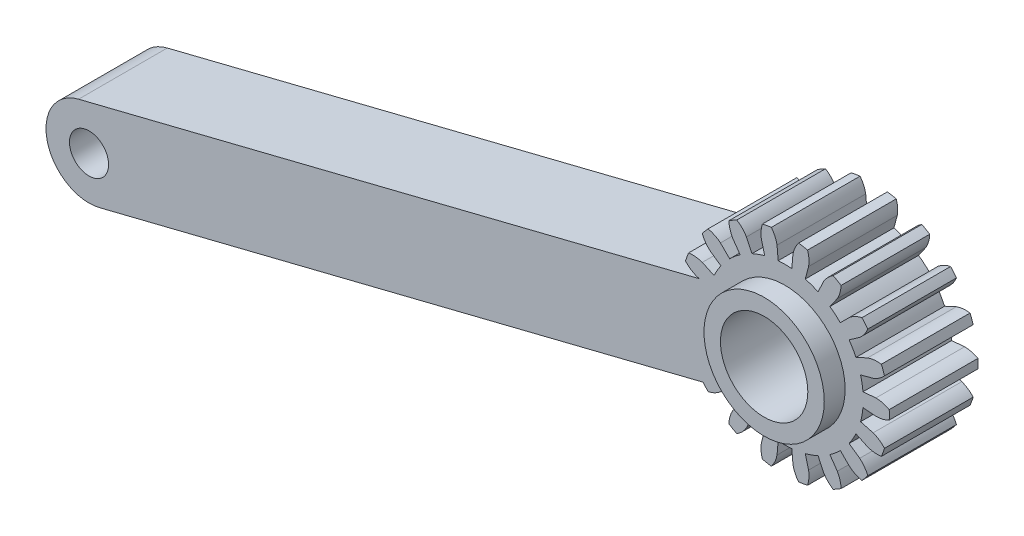
from build123d import *

# Parameters (mm, degrees)
BOSS_EXTRUDE1_DEPTH = 12.7
CIRPATTERN1_COUNT   = 18
SKETCH3_W           = 2.032
SKETCH3_H           = 4.860083526
SKETCH5_R           = 1.905
BOSS_EXTRUDE3_DEPTH = 4.318
SKETCH6_R           = 5.855880208
CUT_EXTRUDE1_DEPTH  = 2.032
SKETCH7_R           = 4.2545
CUT_EXTRUDE2_DEPTH  = 95.903955419


with BuildPart() as part:
    # Sketch2 → Boss-Extrude1 (new body)
    with BuildSketch(Plane.XY):
        with BuildLine():
            Line((-4.887741292, -28.137706194), (-1.385764922, -28.755199114))
            ThreePointArc((-1.385764922, -28.755199114), (-1.335190156, -28.426609585), (-1.298996401, -28.09612676))
            Line((-1.298996401, -28.09612676), (-0.037512469, -28.206492303))
            ThreePointArc((-0.037512469, -28.206492303), (0.631557066, -28.119757595), (1.260329931, -27.875172976))
            ThreePointArc((1.260329931, -27.875172976), (1.27, -27.432), (1.260329931, -26.988827024))
            ThreePointArc((1.260329931, -26.988827024), (0.631557066, -26.744242405), (-0.037512469, -26.657507697))
            Line((-0.037512469, -26.657507697), (-1.298996401, -26.76787324))
            ThreePointArc((-1.298996401, -26.76787324), (-1.335190156, -26.437390415), (-1.385764922, -26.108800886))
            Line((-1.385764922, -26.108800886), (-4.887741292, -26.726293806))
            ThreePointArc((-4.887741292, -26.726293806), (-4.826, -27.432), (-4.887741292, -28.137706194))
        make_face()
    boss_extrude1 = extrude(amount=BOSS_EXTRUDE1_DEPTH)

    # CirPattern1: Boss-Extrude1 ×18 about axis
    cirpattern1_axis = Axis((-8.89, -27.432, 0), (0, 0, 1))
    for i in range(1, CIRPATTERN1_COUNT):
        add(boss_extrude1.rotate(cirpattern1_axis, i * 360 / CIRPATTERN1_COUNT))

    # Sketch3 → Cut-Revolve1 (revolve, cut)
    with BuildSketch(Plane(origin=(0, -27.432, 0), x_dir=(0, 0, -1), z_dir=(0, -1, 0))):
        with Locations((-11.684, -0.604078029)):
            Rectangle(SKETCH3_W, SKETCH3_H)
        with Locations((-1.016, -0.604078029)):
            Rectangle(SKETCH3_W, SKETCH3_H)
    revolve(axis=Axis((-8.89, -27.432, 12.7), (0, 0, -1)), mode=Mode.SUBTRACT)

    # Sketch5 → Boss-Extrude3 (add, symmetric)
    with BuildSketch(Plane.XY.offset(6.35)):
        with BuildLine():
            Line((-11.843249689, -32.488644073), (-75.646213327, -48.412823701))
            ThreePointArc((-75.646213327, -48.412823701), (-80.727352047, -45.361432), (-77.675960346, -40.280293281))
            Line((-77.675960346, -40.280293281), (-13.872996708, -24.356113653))
            ThreePointArc((-13.872996708, -24.356113653), (-14.571594361, -28.850033333), (-11.843249689, -32.488644073))
        make_face()
        with Locations((-76.661086837, -44.346558491)):
            Circle(SKETCH5_R, mode=Mode.SUBTRACT)
    extrude(amount=BOSS_EXTRUDE3_DEPTH, both=True)

    # Sketch6 → Cut-Extrude1 (cut)
    with BuildSketch(Plane(origin=(0, 0, 2.032), x_dir=(-1, 0, 0), z_dir=(0, 0, -1))):
        with Locations(Location((8.89, -27.432, 0), (0, 0, 180))):
            Circle(SKETCH6_R)
    extrude(amount=CUT_EXTRUDE1_DEPTH, mode=Mode.SUBTRACT)

    # Sketch7 → Cut-Extrude2 (cut, through all)
    with BuildSketch(Plane.XY.offset(12.7)):
        with Locations((-8.89, -27.432)):
            Circle(SKETCH7_R)
    extrude(amount=-CUT_EXTRUDE2_DEPTH, mode=Mode.SUBTRACT)


solid = part.part
